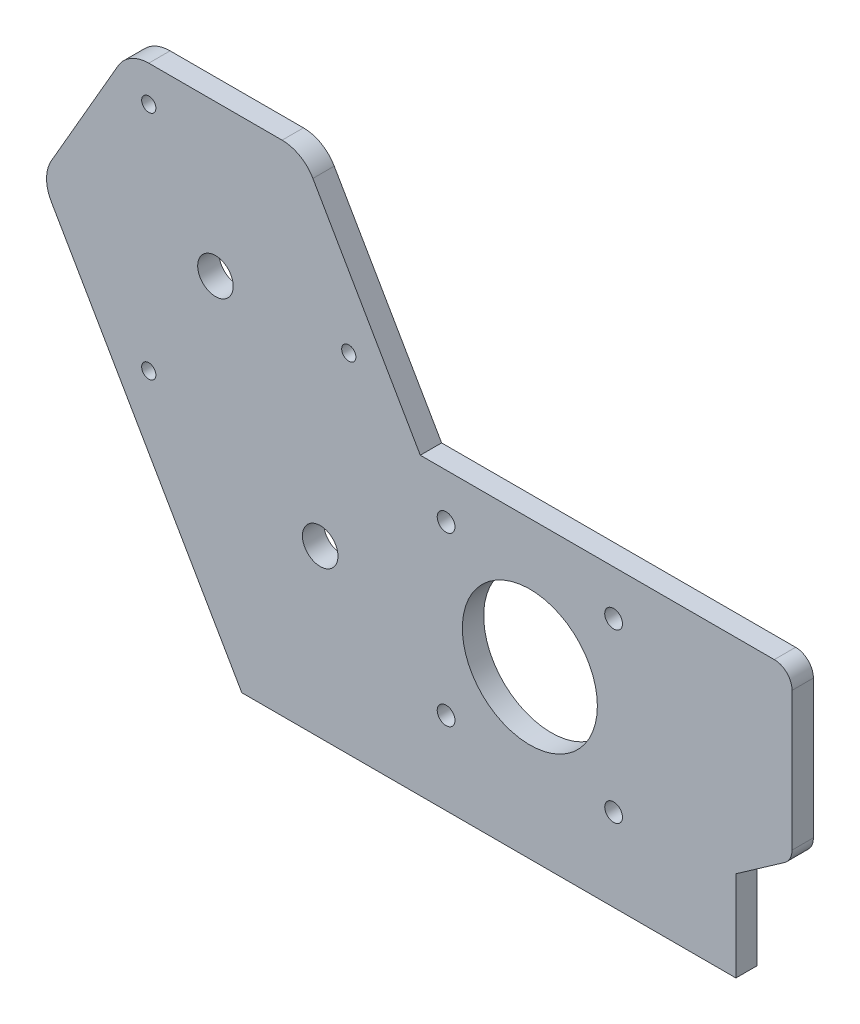
from build123d import *

# Parameters (mm, degrees)
SKETCH2_R           = 2.5
SKETCH2_R_2         = 19
SKETCH2_R_3         = 5
SKETCH2_R_4         = 2
BOSS_EXTRUDE2_DEPTH = 6


with BuildPart() as part:
    # Sketch2 → Boss-Extrude2 (new body)
    with BuildSketch(Plane.XY):
        with BuildLine():
            Line((-69.048275573, 22), (70, 22))
            Line((70, 22), (70, 47.4))
            Line((70, 47.4), (83.667882182, 56.970354135))
            ThreePointArc((83.667882182, 56.970354135), (85.235054166, 58.75737129), (85.8, 61.066114356))
            Line((85.8, 61.066114356), (85.8, 100))
            ThreePointArc((85.8, 100), (84.335533906, 103.535533906), (80.8, 105))
            Line((80.8, 105), (-18.818802154, 105))
            Line((-18.818802154, 105), (-49.04048999, 157.345498823))
            ThreePointArc((-49.04048999, 157.345498823), (-52.700744028, 161.005752861), (-57.700744028, 162.345498823))
            Line((-57.700744028, 162.345498823), (-95.228511525, 162.345498823))
            ThreePointArc((-95.228511525, 162.345498823), (-100.228511525, 161.005752861), (-103.888765563, 157.345498823))
            Line((-103.888765563, 157.345498823), (-122.652649312, 124.845498823))
            ThreePointArc((-122.652649312, 124.845498823), (-123.992395274, 119.845498823), (-122.652649312, 114.845498823))
            Line((-122.652649312, 114.845498823), (-69.048275573, 22))
        make_face()
        with Locations((-11.557721787, 45.22)):
            Circle(SKETCH2_R, mode=Mode.SUBTRACT)
        with Locations((35.582278213, 45.22)):
            Circle(SKETCH2_R, mode=Mode.SUBTRACT)
        with Locations((35.582278213, 92.36)):
            Circle(SKETCH2_R, mode=Mode.SUBTRACT)
        with Locations((12.012278213, 68.79)):
            Circle(SKETCH2_R_2, mode=Mode.SUBTRACT)
        with Locations((-11.557721787, 92.36)):
            Circle(SKETCH2_R, mode=Mode.SUBTRACT)
        with Locations((-46.987721787, 68.79)):
            Circle(SKETCH2_R_3, mode=Mode.SUBTRACT)
        with Locations((-38.936860279, 119.845498823)):
            Circle(SKETCH2_R_4, mode=Mode.SUBTRACT)
        with Locations((-95.228511525, 87.345498823)):
            Circle(SKETCH2_R_4, mode=Mode.SUBTRACT)
        with Locations((-76.464627777, 119.845498823)):
            Circle(SKETCH2_R_3, mode=Mode.SUBTRACT)
        with Locations((-95.228511525, 152.345498823)):
            Circle(SKETCH2_R_4, mode=Mode.SUBTRACT)
    extrude(amount=BOSS_EXTRUDE2_DEPTH)


solid = part.part
